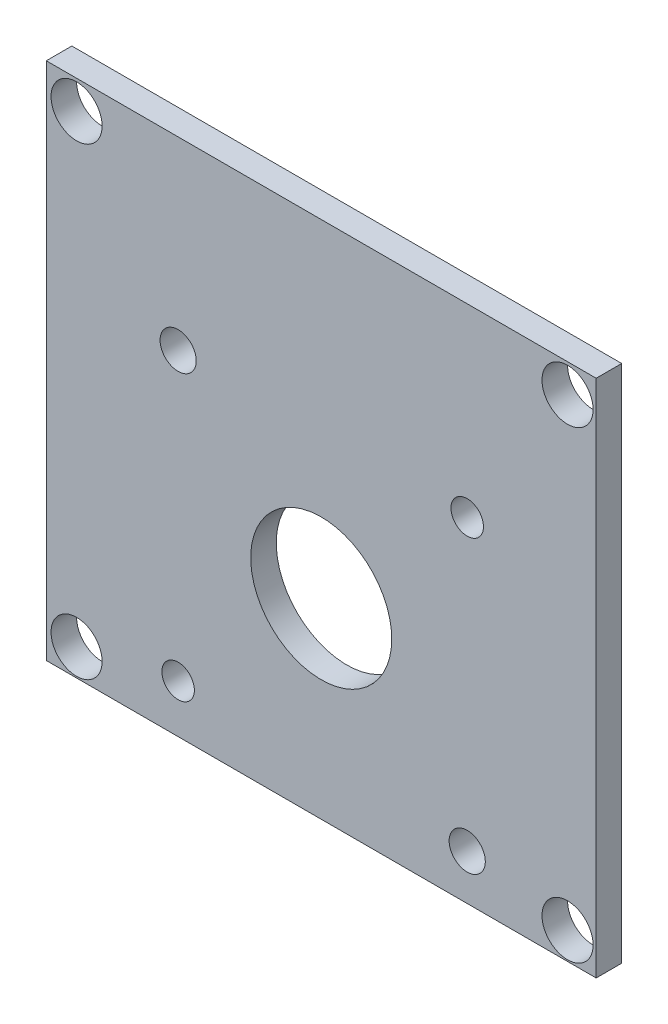
from build123d import *

# Parameters (mm, degrees)
SKETCH1_W           = 68.326
SKETCH1_H           = 64.5414
SKETCH1_R           = 2.0193
SKETCH1_R_2         = 2.2479
SKETCH1_R_3         = 8.763
SKETCH1_R_4         = 3.175
BOSS_EXTRUDE1_DEPTH = 3.175


with BuildPart() as part:
    # Sketch1 → Boss-Extrude1 (new body)
    with BuildSketch(Plane.XY):
        Rectangle(SKETCH1_W, SKETCH1_H)
        with Locations((-17.78, -26.2763)):
            Circle(SKETCH1_R, mode=Mode.SUBTRACT)
        with Locations((18.14068, 9.2837)):
            Circle(SKETCH1_R, mode=Mode.SUBTRACT)
        with Locations((-17.78, 9.2837)):
            Circle(SKETCH1_R_2, mode=Mode.SUBTRACT)
        with Locations((18.141024484, -26.637324484)):
            Circle(SKETCH1_R_2, mode=Mode.SUBTRACT)
        with Locations((0, -8.4963)):
            Circle(SKETCH1_R_3, mode=Mode.SUBTRACT)
        with Locations((-30.398482094, 28.7147)):
            Circle(SKETCH1_R_4, mode=Mode.SUBTRACT)
        with Locations((-30.398482094, -28.91166803)):
            Circle(SKETCH1_R_4, mode=Mode.SUBTRACT)
        with Locations((30.607, -28.91166803)):
            Circle(SKETCH1_R_4, mode=Mode.SUBTRACT)
        with Locations((30.607, 28.7147)):
            Circle(SKETCH1_R_4, mode=Mode.SUBTRACT)
    extrude(amount=BOSS_EXTRUDE1_DEPTH)


solid = part.part
